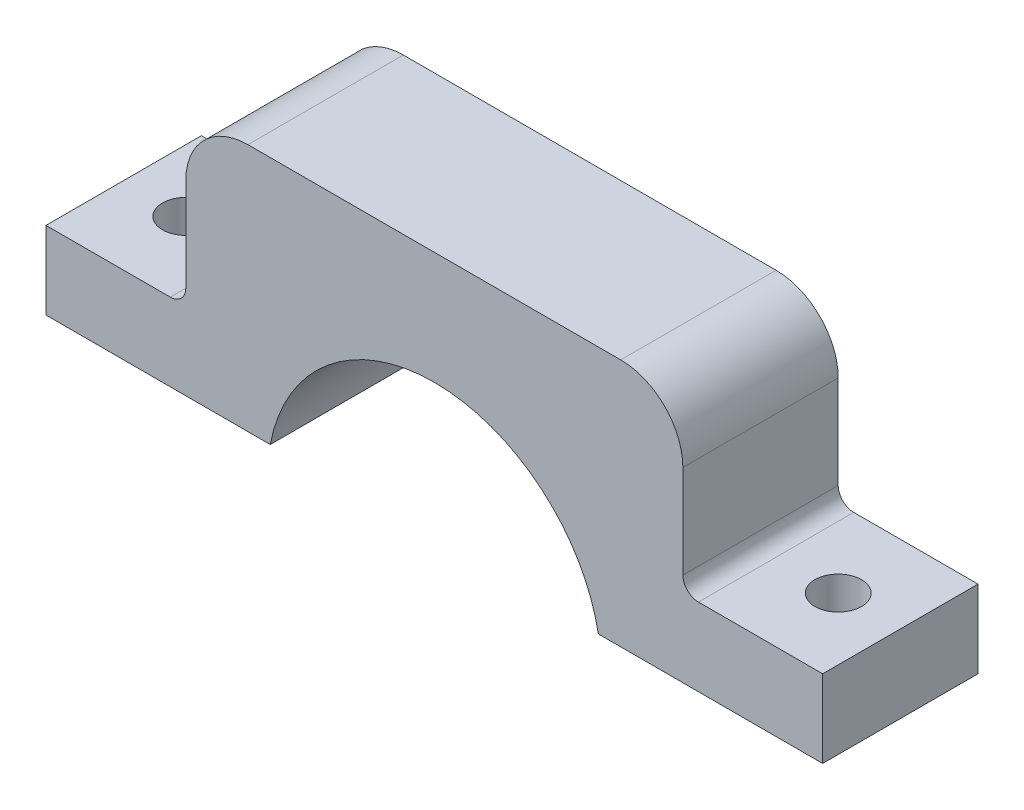
from build123d import *

# Parameters (mm, degrees)
EXTRUDE_1_DEPTH     = 10
SKETCH_3_W          = 32
SKETCH_3_H          = 2
CUT_EXTRUDE_2_DEPTH = 27.076809621
SKETCH_5_W          = 9
SKETCH_5_H          = 5
EXTRUDE_2_DEPTH     = 10
FILLET_1_R          = 1
SKETCH_6_R          = 1.5
CUT_EXTRUDE_3_DEPTH = 30.086079144
FILLET_2_R          = 4


with BuildPart() as part:
    # 草图1 → 凸台-拉伸1 (new body)
    with BuildSketch(Plane.XY):
        with BuildLine():
            ThreePointArc((-10.75, 0), (0, 10.75), (10.75, 0))
            Line((10.75, 0), (16, 0))
            Line((16, 0), (16, 18))
            Line((16, 18), (-16, 18))
            Line((-16, 18), (-16, 0))
            Line((-16, 0), (-10.75, 0))
        make_face()
    extrude(amount=EXTRUDE_1_DEPTH)

    # 草图3 → 切除-拉伸2 (cut, through all)
    with BuildSketch(Plane.XY.offset(10)):
        with Locations((0, 1)):
            Rectangle(SKETCH_3_W, SKETCH_3_H)
    extrude(amount=-CUT_EXTRUDE_2_DEPTH, mode=Mode.SUBTRACT)

    # 草图5 → 凸台-拉伸2 (add)
    with BuildSketch(Plane.XY.offset(10)):
        with Locations((20.5, 4.5)):
            Rectangle(SKETCH_5_W, SKETCH_5_H)
        with Locations((-20.5, 4.5)):
            Rectangle(SKETCH_5_W, SKETCH_5_H)
    extrude(amount=-EXTRUDE_2_DEPTH)

    # 圆角1
    fillet_1_edges = [part.edges().sort_by_distance(p)[0] for p in [
        (-16, 7, 5),
        (16, 7, 5),
    ]]
    fillet(fillet_1_edges, radius=FILLET_1_R)

    # 草图6 → 切除-拉伸3 (cut, through all)
    with BuildSketch(Plane(origin=(0, 7, 0), x_dir=(1, 0, 0), z_dir=(0, 1, 0))):
        with Locations(Location((21, -5, 0), (0, 0, 180))):
            Circle(SKETCH_6_R)
        with Locations((-21, -5)):
            Circle(SKETCH_6_R)
    extrude(amount=-CUT_EXTRUDE_3_DEPTH, mode=Mode.SUBTRACT)

    # 圆角2
    fillet_2_edges = [part.edges().sort_by_distance(p)[0] for p in [
        (-16, 18, 5),
        (16, 18, 5),
    ]]
    fillet(fillet_2_edges, radius=FILLET_2_R)


solid = part.part
